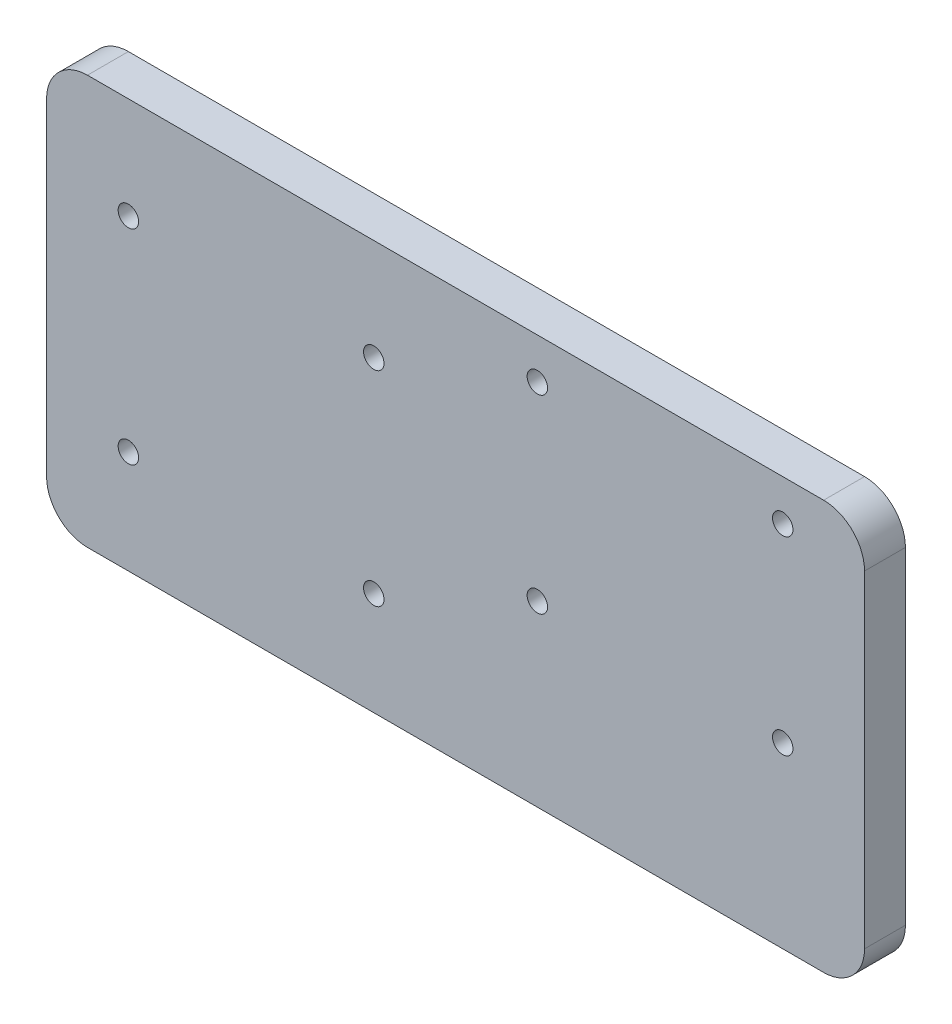
from build123d import *

# Parameters (mm, degrees)
SKETCH4_W                                     = 200
SKETCH4_H                                     = 100
BOSS_EXTRUDE1_DEPTH                           = 10
CBORE_FOR_M6_HEX_HEAD_CAP_SCREW7_D            = 6
CBORE_FOR_M6_HEX_HEAD_CAP_SCREW7_DEPTH        = 8
CBORE_FOR_M6_HEX_HEAD_CAP_SCREW7_CBORE_D      = 8
CBORE_FOR_M6_HEX_HEAD_CAP_SCREW7_CBORE_DEPTH  = 2
CBORE_FOR_M6_HEX_HEAD_CAP_SCREW7_TIP          = 1.802581857
CBORE_FOR_M6_HEX_HEAD_CAP_SCREW8_D            = 6
CBORE_FOR_M6_HEX_HEAD_CAP_SCREW8_DEPTH        = 8
CBORE_FOR_M6_HEX_HEAD_CAP_SCREW8_CBORE_D      = 8
CBORE_FOR_M6_HEX_HEAD_CAP_SCREW8_CBORE_DEPTH  = 2
CBORE_FOR_M6_HEX_HEAD_CAP_SCREW8_TIP          = 1.802581857
CBORE_FOR_M6_HEX_HEAD_CAP_SCREW9_D            = 6
CBORE_FOR_M6_HEX_HEAD_CAP_SCREW9_DEPTH        = 8
CBORE_FOR_M6_HEX_HEAD_CAP_SCREW9_CBORE_D      = 8
CBORE_FOR_M6_HEX_HEAD_CAP_SCREW9_CBORE_DEPTH  = 2
CBORE_FOR_M6_HEX_HEAD_CAP_SCREW9_TIP          = 1.802581857
CBORE_FOR_M6_HEX_HEAD_CAP_SCREW10_D           = 6
CBORE_FOR_M6_HEX_HEAD_CAP_SCREW10_DEPTH       = 8
CBORE_FOR_M6_HEX_HEAD_CAP_SCREW10_CBORE_D     = 8
CBORE_FOR_M6_HEX_HEAD_CAP_SCREW10_CBORE_DEPTH = 2
CBORE_FOR_M6_HEX_HEAD_CAP_SCREW10_TIP         = 1.802581857
F_1_0_1_DIAMETER_HOLE7_D                      = 5
F_1_0_1_DIAMETER_HOLE7_DEPTH                  = 8
F_1_0_1_DIAMETER_HOLE7_TIP                    = 1.502151548
F_1_0_1_DIAMETER_HOLE8_D                      = 5
F_1_0_1_DIAMETER_HOLE8_DEPTH                  = 8
F_1_0_1_DIAMETER_HOLE8_TIP                    = 1.502151548
F_1_0_1_DIAMETER_HOLE9_D                      = 5
F_1_0_1_DIAMETER_HOLE9_DEPTH                  = 8
F_1_0_1_DIAMETER_HOLE9_TIP                    = 1.502151548
F_1_0_1_DIAMETER_HOLE10_D                     = 5
F_1_0_1_DIAMETER_HOLE10_DEPTH                 = 8
F_1_0_1_DIAMETER_HOLE10_TIP                   = 1.502151548
F_5_0_5_DIAMETER_HOLE1_D                      = 5
F_5_0_5_DIAMETER_HOLE1_DEPTH                  = 8
F_5_0_5_DIAMETER_HOLE1_TIP                    = 1.502151548
F_5_0_5_DIAMETER_HOLE2_D                      = 5
F_5_0_5_DIAMETER_HOLE2_DEPTH                  = 8
F_5_0_5_DIAMETER_HOLE2_TIP                    = 1.502151548
F_5_0_5_DIAMETER_HOLE3_D                      = 5
F_5_0_5_DIAMETER_HOLE3_DEPTH                  = 8
F_5_0_5_DIAMETER_HOLE3_TIP                    = 1.502151548
F_5_0_5_DIAMETER_HOLE5_D                      = 5
F_5_0_5_DIAMETER_HOLE5_DEPTH                  = 8
F_5_0_5_DIAMETER_HOLE5_TIP                    = 1.502151548
FILLET1_R                                     = 10
FILLET2_R                                     = 10
FILLET3_R                                     = 10
FILLET4_R                                     = 10
CBORE_FOR_M6_HEX_HEAD_CAP_SCREW3_D            = 6
CBORE_FOR_M6_HEX_HEAD_CAP_SCREW3_DEPTH        = 8
CBORE_FOR_M6_HEX_HEAD_CAP_SCREW3_CBORE_D      = 8
CBORE_FOR_M6_HEX_HEAD_CAP_SCREW3_CBORE_DEPTH  = 2
CBORE_FOR_M6_HEX_HEAD_CAP_SCREW3_TIP          = 1.802581857
CBORE_FOR_M6_HEX_HEAD_CAP_SCREW4_D            = 6
CBORE_FOR_M6_HEX_HEAD_CAP_SCREW4_DEPTH        = 8
CBORE_FOR_M6_HEX_HEAD_CAP_SCREW4_CBORE_D      = 8
CBORE_FOR_M6_HEX_HEAD_CAP_SCREW4_CBORE_DEPTH  = 2
CBORE_FOR_M6_HEX_HEAD_CAP_SCREW4_TIP          = 1.802581857
CBORE_FOR_M6_HEX_HEAD_CAP_SCREW6_D            = 6
CBORE_FOR_M6_HEX_HEAD_CAP_SCREW6_DEPTH        = 8
CBORE_FOR_M6_HEX_HEAD_CAP_SCREW6_CBORE_D      = 8
CBORE_FOR_M6_HEX_HEAD_CAP_SCREW6_CBORE_DEPTH  = 2
CBORE_FOR_M6_HEX_HEAD_CAP_SCREW6_TIP          = 1.802581857


with BuildPart() as part:
    # Sketch4 → Boss-Extrude1 (new body)
    with BuildSketch(Plane.XY):
        with Locations((100, 50)):
            Rectangle(SKETCH4_W, SKETCH4_H)
    extrude(amount=BOSS_EXTRUDE1_DEPTH)

    # CBORE for M6 Hex Head Cap Screw7
    with Locations(Plane(origin=(0, 0, 0), x_dir=(-1, 0, 0), z_dir=(0, 0, -1))):
        with Locations((-80, 83.464013217)):
            CounterBoreHole(CBORE_FOR_M6_HEX_HEAD_CAP_SCREW7_D / 2, CBORE_FOR_M6_HEX_HEAD_CAP_SCREW7_CBORE_D / 2, CBORE_FOR_M6_HEX_HEAD_CAP_SCREW7_CBORE_DEPTH, depth=CBORE_FOR_M6_HEX_HEAD_CAP_SCREW7_DEPTH)
            with Locations((0, 0, -(CBORE_FOR_M6_HEX_HEAD_CAP_SCREW7_DEPTH + CBORE_FOR_M6_HEX_HEAD_CAP_SCREW7_TIP / 2))):  # 118° drill point
                Cone(0, CBORE_FOR_M6_HEX_HEAD_CAP_SCREW7_D / 2, CBORE_FOR_M6_HEX_HEAD_CAP_SCREW7_TIP, mode=Mode.SUBTRACT)

    # CBORE for M6 Hex Head Cap Screw8
    with Locations(Plane(origin=(0, 0, 0), x_dir=(-1, 0, 0), z_dir=(0, 0, -1))):
        with Locations((-20, 83.464013217)):
            CounterBoreHole(CBORE_FOR_M6_HEX_HEAD_CAP_SCREW8_D / 2, CBORE_FOR_M6_HEX_HEAD_CAP_SCREW8_CBORE_D / 2, CBORE_FOR_M6_HEX_HEAD_CAP_SCREW8_CBORE_DEPTH, depth=CBORE_FOR_M6_HEX_HEAD_CAP_SCREW8_DEPTH)
            with Locations((0, 0, -(CBORE_FOR_M6_HEX_HEAD_CAP_SCREW8_DEPTH + CBORE_FOR_M6_HEX_HEAD_CAP_SCREW8_TIP / 2))):  # 118° drill point
                Cone(0, CBORE_FOR_M6_HEX_HEAD_CAP_SCREW8_D / 2, CBORE_FOR_M6_HEX_HEAD_CAP_SCREW8_TIP, mode=Mode.SUBTRACT)

    # CBORE for M6 Hex Head Cap Screw9
    with Locations(Plane(origin=(0, 0, 0), x_dir=(-1, 0, 0), z_dir=(0, 0, -1))):
        with Locations((-20, 16.814013217)):
            CounterBoreHole(CBORE_FOR_M6_HEX_HEAD_CAP_SCREW9_D / 2, CBORE_FOR_M6_HEX_HEAD_CAP_SCREW9_CBORE_D / 2, CBORE_FOR_M6_HEX_HEAD_CAP_SCREW9_CBORE_DEPTH, depth=CBORE_FOR_M6_HEX_HEAD_CAP_SCREW9_DEPTH)
            with Locations((0, 0, -(CBORE_FOR_M6_HEX_HEAD_CAP_SCREW9_DEPTH + CBORE_FOR_M6_HEX_HEAD_CAP_SCREW9_TIP / 2))):  # 118° drill point
                Cone(0, CBORE_FOR_M6_HEX_HEAD_CAP_SCREW9_D / 2, CBORE_FOR_M6_HEX_HEAD_CAP_SCREW9_TIP, mode=Mode.SUBTRACT)

    # CBORE for M6 Hex Head Cap Screw10
    with Locations(Plane(origin=(0, 0, 0), x_dir=(-1, 0, 0), z_dir=(0, 0, -1))):
        with Locations((-80, 16.814013217)):
            CounterBoreHole(CBORE_FOR_M6_HEX_HEAD_CAP_SCREW10_D / 2, CBORE_FOR_M6_HEX_HEAD_CAP_SCREW10_CBORE_D / 2, CBORE_FOR_M6_HEX_HEAD_CAP_SCREW10_CBORE_DEPTH, depth=CBORE_FOR_M6_HEX_HEAD_CAP_SCREW10_DEPTH)
            with Locations((0, 0, -(CBORE_FOR_M6_HEX_HEAD_CAP_SCREW10_DEPTH + CBORE_FOR_M6_HEX_HEAD_CAP_SCREW10_TIP / 2))):  # 118° drill point
                Cone(0, CBORE_FOR_M6_HEX_HEAD_CAP_SCREW10_D / 2, CBORE_FOR_M6_HEX_HEAD_CAP_SCREW10_TIP, mode=Mode.SUBTRACT)

    # Ø1.0 (1) Diameter Hole7
    with Locations(Plane.XY.offset(10)):
        with Locations((20, 75.196019825)):
            Hole(F_1_0_1_DIAMETER_HOLE7_D / 2, depth=F_1_0_1_DIAMETER_HOLE7_DEPTH)
            with Locations((0, 0, -(F_1_0_1_DIAMETER_HOLE7_DEPTH + F_1_0_1_DIAMETER_HOLE7_TIP / 2))):  # 118° drill point
                Cone(0, F_1_0_1_DIAMETER_HOLE7_D / 2, F_1_0_1_DIAMETER_HOLE7_TIP, mode=Mode.SUBTRACT)

    # Ø1.0 (1) Diameter Hole8
    with Locations(Plane.XY.offset(10)):
        with Locations((80, 75.196019825)):
            Hole(F_1_0_1_DIAMETER_HOLE8_D / 2, depth=F_1_0_1_DIAMETER_HOLE8_DEPTH)
            with Locations((0, 0, -(F_1_0_1_DIAMETER_HOLE8_DEPTH + F_1_0_1_DIAMETER_HOLE8_TIP / 2))):  # 118° drill point
                Cone(0, F_1_0_1_DIAMETER_HOLE8_D / 2, F_1_0_1_DIAMETER_HOLE8_TIP, mode=Mode.SUBTRACT)

    # Ø1.0 (1) Diameter Hole9
    with Locations(Plane.XY.offset(10)):
        with Locations((20, 25.221019825)):
            Hole(F_1_0_1_DIAMETER_HOLE9_D / 2, depth=F_1_0_1_DIAMETER_HOLE9_DEPTH)
            with Locations((0, 0, -(F_1_0_1_DIAMETER_HOLE9_DEPTH + F_1_0_1_DIAMETER_HOLE9_TIP / 2))):  # 118° drill point
                Cone(0, F_1_0_1_DIAMETER_HOLE9_D / 2, F_1_0_1_DIAMETER_HOLE9_TIP, mode=Mode.SUBTRACT)

    # Ø1.0 (1) Diameter Hole10
    with Locations(Plane.XY.offset(10)):
        with Locations((80, 25.221019825)):
            Hole(F_1_0_1_DIAMETER_HOLE10_D / 2, depth=F_1_0_1_DIAMETER_HOLE10_DEPTH)
            with Locations((0, 0, -(F_1_0_1_DIAMETER_HOLE10_DEPTH + F_1_0_1_DIAMETER_HOLE10_TIP / 2))):  # 118° drill point
                Cone(0, F_1_0_1_DIAMETER_HOLE10_D / 2, F_1_0_1_DIAMETER_HOLE10_TIP, mode=Mode.SUBTRACT)

    # Ø5.0 (5) Diameter Hole1
    with Locations(Plane.XY.offset(10)):
        with Locations((120, 90)):
            Hole(F_5_0_5_DIAMETER_HOLE1_D / 2, depth=F_5_0_5_DIAMETER_HOLE1_DEPTH)
            with Locations((0, 0, -(F_5_0_5_DIAMETER_HOLE1_DEPTH + F_5_0_5_DIAMETER_HOLE1_TIP / 2))):  # 118° drill point
                Cone(0, F_5_0_5_DIAMETER_HOLE1_D / 2, F_5_0_5_DIAMETER_HOLE1_TIP, mode=Mode.SUBTRACT)

    # Ø5.0 (5) Diameter Hole2
    with Locations(Plane.XY.offset(10)):
        with Locations((180, 90)):
            Hole(F_5_0_5_DIAMETER_HOLE2_D / 2, depth=F_5_0_5_DIAMETER_HOLE2_DEPTH)
            with Locations((0, 0, -(F_5_0_5_DIAMETER_HOLE2_DEPTH + F_5_0_5_DIAMETER_HOLE2_TIP / 2))):  # 118° drill point
                Cone(0, F_5_0_5_DIAMETER_HOLE2_D / 2, F_5_0_5_DIAMETER_HOLE2_TIP, mode=Mode.SUBTRACT)

    # Ø5.0 (5) Diameter Hole3
    with Locations(Plane.XY.offset(10)):
        with Locations((120, 43.628026433)):
            Hole(F_5_0_5_DIAMETER_HOLE3_D / 2, depth=F_5_0_5_DIAMETER_HOLE3_DEPTH)
            with Locations((0, 0, -(F_5_0_5_DIAMETER_HOLE3_DEPTH + F_5_0_5_DIAMETER_HOLE3_TIP / 2))):  # 118° drill point
                Cone(0, F_5_0_5_DIAMETER_HOLE3_D / 2, F_5_0_5_DIAMETER_HOLE3_TIP, mode=Mode.SUBTRACT)

    # Ø5.0 (5) Diameter Hole5
    with Locations(Plane.XY.offset(10)):
        with Locations((180, 43.628026433)):
            Hole(F_5_0_5_DIAMETER_HOLE5_D / 2, depth=F_5_0_5_DIAMETER_HOLE5_DEPTH)
            with Locations((0, 0, -(F_5_0_5_DIAMETER_HOLE5_DEPTH + F_5_0_5_DIAMETER_HOLE5_TIP / 2))):  # 118° drill point
                Cone(0, F_5_0_5_DIAMETER_HOLE5_D / 2, F_5_0_5_DIAMETER_HOLE5_TIP, mode=Mode.SUBTRACT)

    # Fillet1
    fillet1_edges = [part.edges().sort_by_distance(p)[0] for p in [
        (0, 100, 5),
    ]]
    fillet(fillet1_edges, radius=FILLET1_R)

    # Fillet2
    fillet2_edges = [part.edges().sort_by_distance(p)[0] for p in [
        (0, 0, 5),
    ]]
    fillet(fillet2_edges, radius=FILLET2_R)

    # Fillet3
    fillet3_edges = [part.edges().sort_by_distance(p)[0] for p in [
        (200, 0, 5),
    ]]
    fillet(fillet3_edges, radius=FILLET3_R)

    # Fillet4
    fillet4_edges = [part.edges().sort_by_distance(p)[0] for p in [
        (200, 100, 5),
    ]]
    fillet(fillet4_edges, radius=FILLET4_R)

    # CBORE for M6 Hex Head Cap Screw3
    with Locations(Plane(origin=(0, 0, 0), x_dir=(-1, 0, 0), z_dir=(0, 0, -1))):
        with Locations((-80, 16.814013217)):
            CounterBoreHole(CBORE_FOR_M6_HEX_HEAD_CAP_SCREW3_D / 2, CBORE_FOR_M6_HEX_HEAD_CAP_SCREW3_CBORE_D / 2, CBORE_FOR_M6_HEX_HEAD_CAP_SCREW3_CBORE_DEPTH, depth=CBORE_FOR_M6_HEX_HEAD_CAP_SCREW3_DEPTH)
            with Locations((0, 0, -(CBORE_FOR_M6_HEX_HEAD_CAP_SCREW3_DEPTH + CBORE_FOR_M6_HEX_HEAD_CAP_SCREW3_TIP / 2))):  # 118° drill point
                Cone(0, CBORE_FOR_M6_HEX_HEAD_CAP_SCREW3_D / 2, CBORE_FOR_M6_HEX_HEAD_CAP_SCREW3_TIP, mode=Mode.SUBTRACT)

    # CBORE for M6 Hex Head Cap Screw4
    with Locations(Plane(origin=(0, 0, 0), x_dir=(-1, 0, 0), z_dir=(0, 0, -1))):
        with Locations((-20, 16.814013217)):
            CounterBoreHole(CBORE_FOR_M6_HEX_HEAD_CAP_SCREW4_D / 2, CBORE_FOR_M6_HEX_HEAD_CAP_SCREW4_CBORE_D / 2, CBORE_FOR_M6_HEX_HEAD_CAP_SCREW4_CBORE_DEPTH, depth=CBORE_FOR_M6_HEX_HEAD_CAP_SCREW4_DEPTH)
            with Locations((0, 0, -(CBORE_FOR_M6_HEX_HEAD_CAP_SCREW4_DEPTH + CBORE_FOR_M6_HEX_HEAD_CAP_SCREW4_TIP / 2))):  # 118° drill point
                Cone(0, CBORE_FOR_M6_HEX_HEAD_CAP_SCREW4_D / 2, CBORE_FOR_M6_HEX_HEAD_CAP_SCREW4_TIP, mode=Mode.SUBTRACT)

    # CBORE for M6 Hex Head Cap Screw6
    with Locations(Plane(origin=(0, 0, 0), x_dir=(-1, 0, 0), z_dir=(0, 0, -1))):
        with Locations((-20, 83.464013217)):
            CounterBoreHole(CBORE_FOR_M6_HEX_HEAD_CAP_SCREW6_D / 2, CBORE_FOR_M6_HEX_HEAD_CAP_SCREW6_CBORE_D / 2, CBORE_FOR_M6_HEX_HEAD_CAP_SCREW6_CBORE_DEPTH, depth=CBORE_FOR_M6_HEX_HEAD_CAP_SCREW6_DEPTH)
            with Locations((0, 0, -(CBORE_FOR_M6_HEX_HEAD_CAP_SCREW6_DEPTH + CBORE_FOR_M6_HEX_HEAD_CAP_SCREW6_TIP / 2))):  # 118° drill point
                Cone(0, CBORE_FOR_M6_HEX_HEAD_CAP_SCREW6_D / 2, CBORE_FOR_M6_HEX_HEAD_CAP_SCREW6_TIP, mode=Mode.SUBTRACT)


solid = part.part
